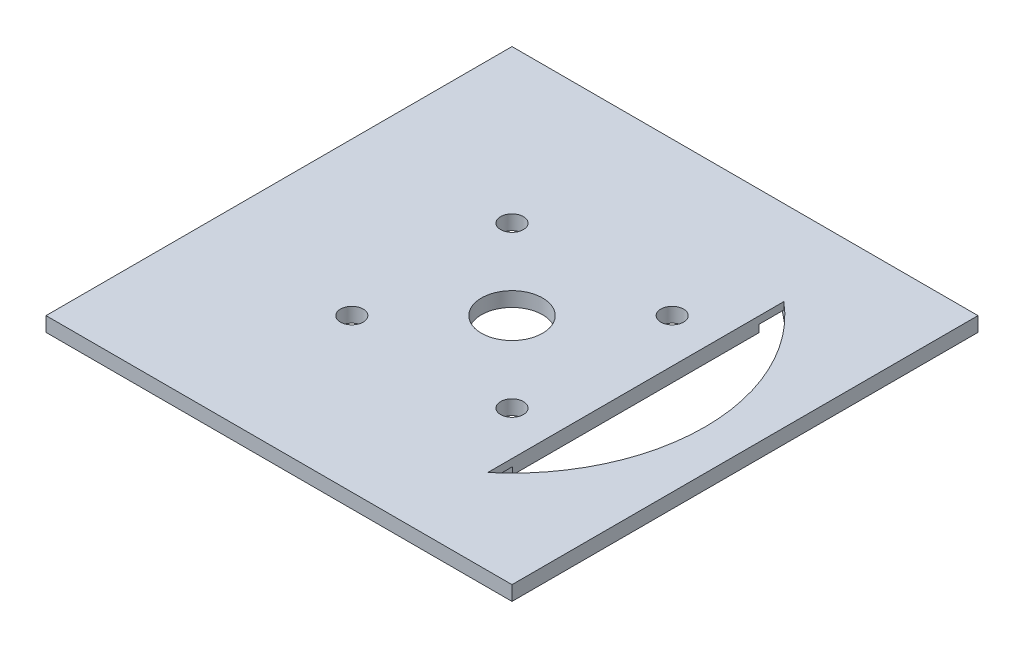
from build123d import *

# Parameters (mm, degrees)
SKETCH1_W           = 203.2
SKETCH1_H           = 203.2
BOSS_EXTRUDE1_DEPTH = 3.175
CUT_EXTRUDE1_DEPTH  = 6.35
SKETCH3_R           = 4.953
SKETCH3_R_2         = 13.335
CUT_EXTRUDE2_DEPTH  = 12.7
CUT_EXTRUDE3_START  = -3.175
SKETCH4_R           = 84.1375
SKETCH4_R_2         = 76.2
CUT_EXTRUDE3_DEPTH  = 3.175


with BuildPart() as part:
    # Sketch1 → Boss-Extrude1 (new, symmetric)
    with BuildSketch(Plane(origin=(0, 0, 0), x_dir=(1, 0, 0), z_dir=(0, 1, 0))):
        Rectangle(SKETCH1_W, SKETCH1_H)
    extrude(amount=BOSS_EXTRUDE1_DEPTH, both=True)

    # Sketch2 → Cut-Extrude1 (cut, symmetric)
    with BuildSketch(Plane(origin=(0, 0, 0), x_dir=(1, 0, 0), z_dir=(0, 1, 0))):
        with BuildLine():
            Line((53.975, -64.543150537), (53.975, 64.543150537))
            ThreePointArc((53.975, 64.543150537), (84.1375, 0), (53.975, -64.543150537))
        make_face()
    extrude(amount=CUT_EXTRUDE1_DEPTH, both=True, mode=Mode.SUBTRACT)

    # Sketch3 → Cut-Extrude2 (cut)
    with BuildSketch(Plane(origin=(0, 3.175, 0), x_dir=(1, 0, 0), z_dir=(0, 1, 0))):
        with Locations(Location((-34.925, -34.925, 0), (0, 0, 270))):
            Circle(SKETCH3_R)
        with Locations(Location((-34.925, 34.925, 0), (0, 0, 270))):
            Circle(SKETCH3_R)
        with Locations(Location((34.925, 34.925, 0), (0, 0, 270))):
            Circle(SKETCH3_R)
        with Locations(Location((34.925, -34.925, 0), (0, 0, 270))):
            Circle(SKETCH3_R)
        with Locations(Location((0, 0, 0), (0, 0, 270))):
            Circle(SKETCH3_R_2)
    extrude(amount=-CUT_EXTRUDE2_DEPTH, mode=Mode.SUBTRACT)

    # Sketch4 → Cut-Extrude3 (cut)
    with BuildSketch(Plane.XZ.offset(3.175).offset(CUT_EXTRUDE3_START)):
        with Locations(Location((0, 0, 0), (0, 0, 50.095533509))):
            Circle(SKETCH4_R)
        Circle(SKETCH4_R_2, mode=Mode.SUBTRACT)
    extrude(amount=CUT_EXTRUDE3_DEPTH, mode=Mode.SUBTRACT)


solid = part.part
